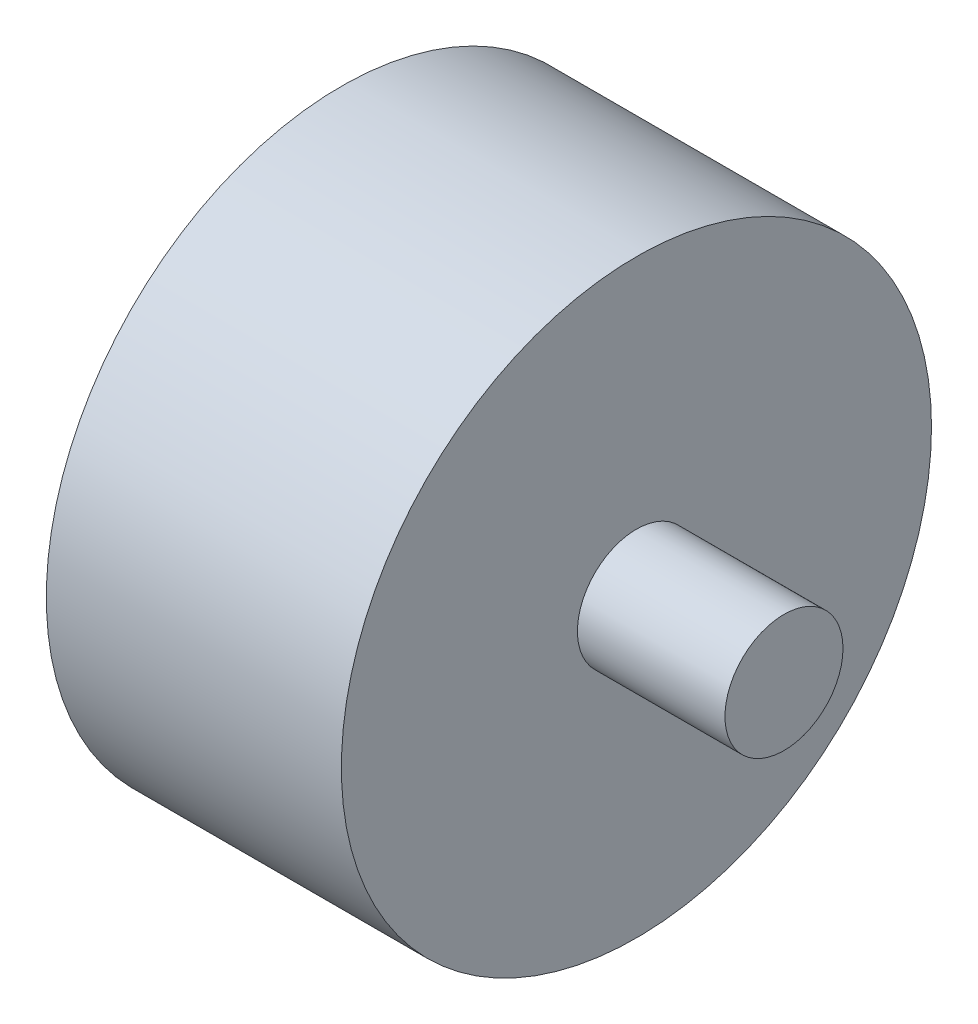
from build123d import *


with BuildPart() as part:
    # 草图1 → 旋转1 (revolve)
    with BuildSketch(Plane.XY, mode=Mode.PRIVATE) as revolve_1_sk:
        Polygon((-10, 4), (-10, 0), (30, 0), (30, 4), (20, 4), (20, 20), (0, 20), (0, 4), align=None)
    revolve(revolve_1_sk.sketch.rotate(Axis((-10, 0, 0), (1, 0, 0)), 270), axis=Axis((-10, 0, 0), (1, 0, 0)))


solid = part.part
